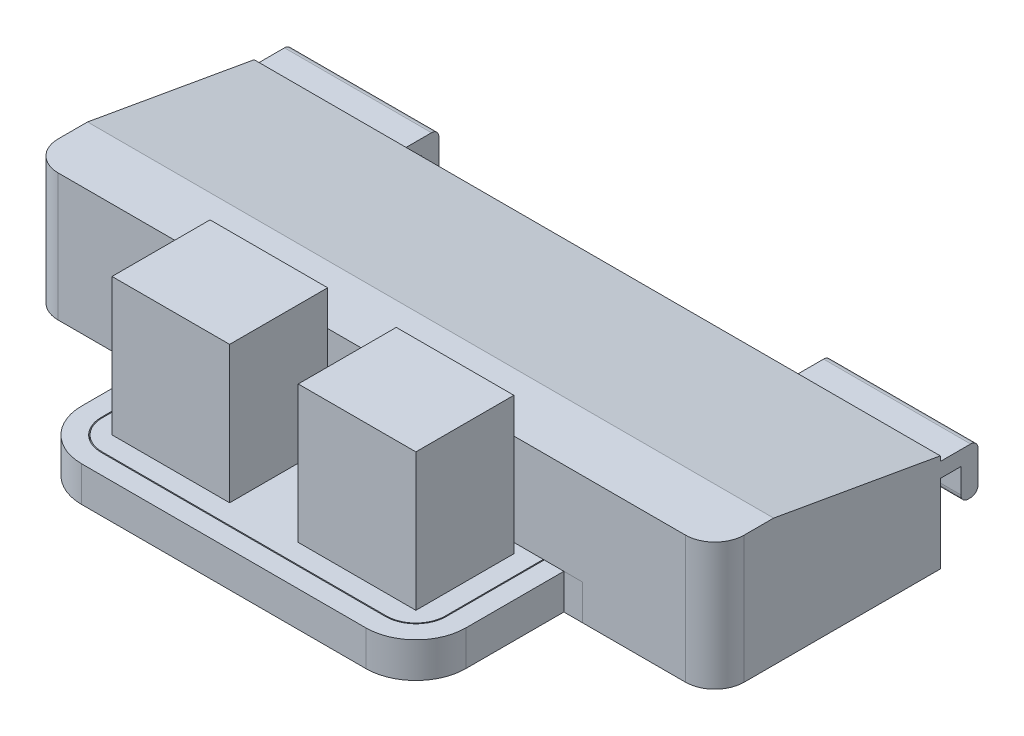
from build123d import *

# Parameters (mm, degrees)
BOSS_EXTRUDE1_DEPTH             = 1.6
SKETCH2_R                       = 1.5
CUT_EXTRUDE1_DEPTH              = 39.766093432
FILLET1_R                       = 3
SKETCH3_W                       = 12
SKETCH3_H                       = 10
BOSS_EXTRUDE2_DEPTH             = 14
BOSS_EXTRUDE3_DEPTH             = 2
BOSS_EXTRUDE4_DEPTH             = 1.6
CUT_EXTRUDE2_DEPTH              = 52.897591466
BOSS_EXTRUDE5_DEPTH             = 15
CUT_EXTRUDE3_DEPTH              = 53.577181362
CUT_EXTRUDE3_DEPTH_BACK         = 53.577181362
BOSS_EXTRUDE6_REACH             = 54.577
BOSS_EXTRUDE6_DIRECTION_2_REACH = 54.577
SKETCH10_W                      = 43
SKETCH10_H                      = 1
BOSS_EXTRUDE7_DEPTH             = 9.4
CUT_EXTRUDE4_DEPTH              = 1
BOSS_EXTRUDE8_DEPTH             = 15


with BuildPart() as part:
    # Sketch1 → Boss-Extrude1 (new body)
    with BuildSketch(Plane(origin=(0, 0, 0), x_dir=(1, 0, 0), z_dir=(0, 1, 0))):
        Polygon((-17.5, 0), (-17.5, 15), (-24.5, 15), (-24.5, 30), (24.5, 30), (24.5, 15), (17.5, 15), (17.5, 0), align=None)
    extrude(amount=BOSS_EXTRUDE1_DEPTH)

    # Sketch2 → Cut-Extrude1 (cut, through all)
    with BuildSketch(Plane(origin=(0, 1.6, 0), x_dir=(1, 0, 0), z_dir=(0, 1, 0))):
        with Locations(Location((-20.5, 26, 0), (0, 0, 270))):
            Circle(SKETCH2_R)
        with Locations(Location((-20.5, 19, 0), (0, 0, 270))):
            Circle(SKETCH2_R)
        with Locations(Location((20.5, 26, 0), (0, 0, 270))):
            Circle(SKETCH2_R)
        with Locations(Location((20.5, 19, 0), (0, 0, 270))):
            Circle(SKETCH2_R)
    extrude(amount=-CUT_EXTRUDE1_DEPTH, mode=Mode.SUBTRACT)

    # Fillet1
    fillet1_edges = [part.edges().sort_by_distance(p)[0] for p in [
        (-17.5, 0.8, 0),
        (-24.5, 0.8, -15),
        (-24.5, 0.8, -30),
        (24.5, 0.8, -30),
        (24.5, 0.8, -15),
        (17.5, 0.8, 0),
    ]]
    fillet(fillet1_edges, radius=FILLET1_R)

    # Sketch3 → Boss-Extrude2 (add)
    with BuildSketch(Plane(origin=(0, 1.6, 0), x_dir=(1, 0, 0), z_dir=(0, 1, 0))):
        with Locations((-9.5, 7)):
            Rectangle(SKETCH3_W, SKETCH3_H)
        with Locations((9.5, 7)):
            Rectangle(SKETCH3_W, SKETCH3_H)
    extrude(amount=BOSS_EXTRUDE2_DEPTH)


with BuildPart() as body_2:
    # Sketch4 → Boss-Extrude3 (new body)
    with BuildSketch(Plane.XZ):
        with BuildLine():
            Line((-32, -13), (-19.6, -13))
            Line((-19.6, -13), (-19.6, -3))
            ThreePointArc((-19.6, -3), (-18.106244584, 0.606244584), (-14.5, 2.1))
            Line((-14.5, 2.1), (14.5, 2.1))
            ThreePointArc((14.5, 2.1), (18.106244584, 0.606244584), (19.6, -3))
            Line((19.6, -3), (19.6, -13))
            Line((19.6, -13), (32, -13))
            ThreePointArc((32, -13), (34.121320344, -13.878679656), (35, -16))
            Line((35, -16), (35, -35))
            Line((35, -35), (-35, -35))
            Line((-35, -35), (-35, -16))
            ThreePointArc((-35, -16), (-34.121320344, -13.878679656), (-32, -13))
        make_face()
    extrude(amount=BOSS_EXTRUDE3_DEPTH)

    # Sketch6 → Cut-Extrude2 (cut, through all)
    with BuildSketch(Plane(origin=(0, 0, 0), x_dir=(1, 0, 0), z_dir=(0, 1, 0))):
        with BuildLine():
            Line((-35, 16), (-35, 35))
            Line((-35, 35), (-34, 35))
            Line((-34, 35), (-34, 16))
            ThreePointArc((-34, 16), (-33.414213562, 14.585786438), (-32, 14))
            Line((-32, 14), (-21.5, 14))
            Line((-21.5, 14), (-21.5, 13))
            Line((-21.5, 13), (-32, 13))
            ThreePointArc((-32, 13), (-34.121320344, 13.878679656), (-35, 16))
        make_face()
        with BuildLine():
            Line((32, 13), (21.5, 13))
            Line((21.5, 13), (21.5, 14))
            Line((21.5, 14), (32, 14))
            ThreePointArc((32, 14), (33.414213562, 14.585786438), (34, 16))
            Line((34, 16), (34, 35))
            Line((34, 35), (35, 35))
            Line((35, 35), (35, 16))
            ThreePointArc((35, 16), (34.121320344, 13.878679656), (32, 13))
        make_face()
    extrude(amount=-CUT_EXTRUDE2_DEPTH, mode=Mode.SUBTRACT)


with BuildPart() as body_3:
    # Sketch5 → Boss-Extrude4 (new body)
    with BuildSketch(Plane(origin=(0, 0, 0), x_dir=(1, 0, 0), z_dir=(0, 1, 0))):
        with BuildLine():
            Line((-21.5, 13), (-19.6, 13))
            Line((-19.6, 13), (-19.6, 3))
            ThreePointArc((-19.6, 3), (-18.106244584, -0.606244584), (-14.5, -2.1))
            Line((-14.5, -2.1), (14.5, -2.1))
            ThreePointArc((14.5, -2.1), (18.106244584, -0.606244584), (19.6, 3))
            Line((19.6, 3), (19.6, 13))
            Line((19.6, 13), (21.5, 13))
            Line((21.5, 13), (21.5, 14.9))
            Line((21.5, 14.9), (17.6, 14.9))
            Line((17.6, 14.9), (17.6, 3))
            ThreePointArc((17.6, 3), (16.692031022, 0.807968978), (14.5, -0.1))
            Line((14.5, -0.1), (-14.5, -0.1))
            ThreePointArc((-14.5, -0.1), (-16.692031022, 0.807968978), (-17.6, 3))
            Line((-17.6, 3), (-17.6, 14.9))
            Line((-17.6, 14.9), (-21.5, 14.9))
            Line((-21.5, 14.9), (-21.5, 13))
        make_face()
    extrude(amount=BOSS_EXTRUDE4_DEPTH)


with BuildPart() as body_4:
    # Sketch7 → Boss-Extrude5 (new body)
    with BuildSketch(Plane.XZ.offset(2)):
        with BuildLine():
            Line((-21.5, -13), (-32, -13))
            ThreePointArc((-32, -13), (-34.121320344, -13.878679656), (-35, -16))
            Line((-35, -16), (-35, -36))
            Line((-35, -36), (35, -36))
            Line((35, -36), (35, -16))
            ThreePointArc((35, -16), (34.121320344, -13.878679656), (32, -13))
            Line((32, -13), (21.5, -13))
            Line((21.5, -13), (21.5, -14))
            Line((21.5, -14), (32, -14))
            ThreePointArc((32, -14), (33.414213562, -14.585786438), (34, -16))
            Line((34, -16), (34, -35))
            Line((34, -35), (-34, -35))
            Line((-34, -35), (-34, -16))
            ThreePointArc((-34, -16), (-33.414213562, -14.585786438), (-32, -14))
            Line((-32, -14), (-21.5, -14))
            Line((-21.5, -14), (-21.5, -13))
        make_face()
    extrude(amount=-BOSS_EXTRUDE5_DEPTH)

    # Sketch8 → Cut-Extrude3 (cut, two sides: drawn at the far end of the back side and taken through both)
    with BuildSketch(Plane(origin=(0, 0, 0), x_dir=(0, 0, -1), z_dir=(1, 0, 0)).offset(-CUT_EXTRUDE3_DEPTH_BACK)):
        Polygon((36, 8), (19, 11), (13, 11), (13, 13), (36, 13), align=None)
    extrude(amount=CUT_EXTRUDE3_DEPTH + CUT_EXTRUDE3_DEPTH_BACK, mode=Mode.SUBTRACT)

    # Sketch9 → Boss-Extrude6 (add, up to next)
    with BuildSketch(Plane(origin=(0, 0, 0), x_dir=(0, 0, -1), z_dir=(1, 0, 0)), mode=Mode.PRIVATE) as boss_extrude6_sk1:
        Polygon((35, 8.176470588), (19, 11), (14, 11), (14, 9.46), (19.095328416, 9.46), (35, 6.65329325), align=None)
    boss_extrude6_tool1 = extrude(boss_extrude6_sk1.sketch, amount=BOSS_EXTRUDE6_REACH, mode=Mode.PRIVATE) - body_4.part
    add(boss_extrude6_tool1.solids().sort_by_distance((0, 9.16359, -24.478882))[0])

    # Sketch9 → Boss-Extrude6 direction 2 (add, up to next)
    with BuildSketch(Plane(origin=(0, 0, 0), x_dir=(0, 0, -1), z_dir=(1, 0, 0)), mode=Mode.PRIVATE) as boss_extrude6_direction_2_sk1:
        Polygon((35, 8.176470588), (19, 11), (14, 11), (14, 9.46), (19.095328416, 9.46), (35, 6.65329325), align=None)
    boss_extrude6_direction_2_tool1 = extrude(boss_extrude6_direction_2_sk1.sketch, amount=-BOSS_EXTRUDE6_DIRECTION_2_REACH, mode=Mode.PRIVATE) - body_4.part
    add(boss_extrude6_direction_2_tool1.solids().sort_by_distance((0, 9.16359, -24.478882))[0])

    # Sketch11 → Cut-Extrude4 (cut)
    with BuildSketch(Plane(origin=(0, 0, -36), x_dir=(-1, 0, 0), z_dir=(0, 0, -1))):
        with BuildLine():
            Line((-20, 3.2), (20, 3.2))
            ThreePointArc((20, 3.2), (21.6, 1.6), (20, 0))
            Line((20, 0), (-20, 0))
            ThreePointArc((-20, 0), (-21.6, 1.6), (-20, 3.2))
        make_face()
    extrude(amount=-CUT_EXTRUDE4_DEPTH, mode=Mode.SUBTRACT)

    # Sketch12 → Boss-Extrude8 (add)
    with BuildSketch(Plane.ZY.offset(35)):
        with BuildLine():
            Line((-36, 7.5), (-39.1, 7.5))
            ThreePointArc((-39.1, 7.5), (-39.630330086, 7.280330086), (-39.85, 6.75))
            Line((-39.85, 6.75), (-39.85, 3.5))
            ThreePointArc((-39.85, 3.5), (-39.630330086, 2.969669914), (-39.1, 2.75))
            Line((-39.1, 2.75), (-38.85, 2.75))
            ThreePointArc((-38.85, 2.75), (-38.319669914, 2.969669914), (-38.1, 3.5))
            Line((-38.1, 3.5), (-38.1, 6))
            Line((-38.1, 6), (-36, 6))
            Line((-36, 6), (-36, 7.5))
        make_face()
    boss_extrude8 = extrude(amount=-BOSS_EXTRUDE8_DEPTH)

    # Mirror1: Boss-Extrude8 across plane
    add(boss_extrude8.mirror(Plane(origin=(0, 0, 0), x_dir=(0, 0, 1), z_dir=(1, 0, 0))))


with BuildPart() as body_5:
    # Sketch10 → Boss-Extrude7 (new body)
    with BuildSketch(Plane(origin=(0, 11, 0), x_dir=(1, 0, 0), z_dir=(0, 1, 0))):
        with Locations((0, 13.5)):
            Rectangle(SKETCH10_W, SKETCH10_H)
    extrude(amount=-BOSS_EXTRUDE7_DEPTH)


with BuildPart() as body_4_1:
    add(body_4.part)

    # Combine1: union body 5
    add(body_5.part)


with BuildPart() as body_2_1:
    add(body_2.part)

    # Combine2: union body 3
    add(body_3.part)


solid = Compound([part.part, body_4_1.part, body_2_1.part])
